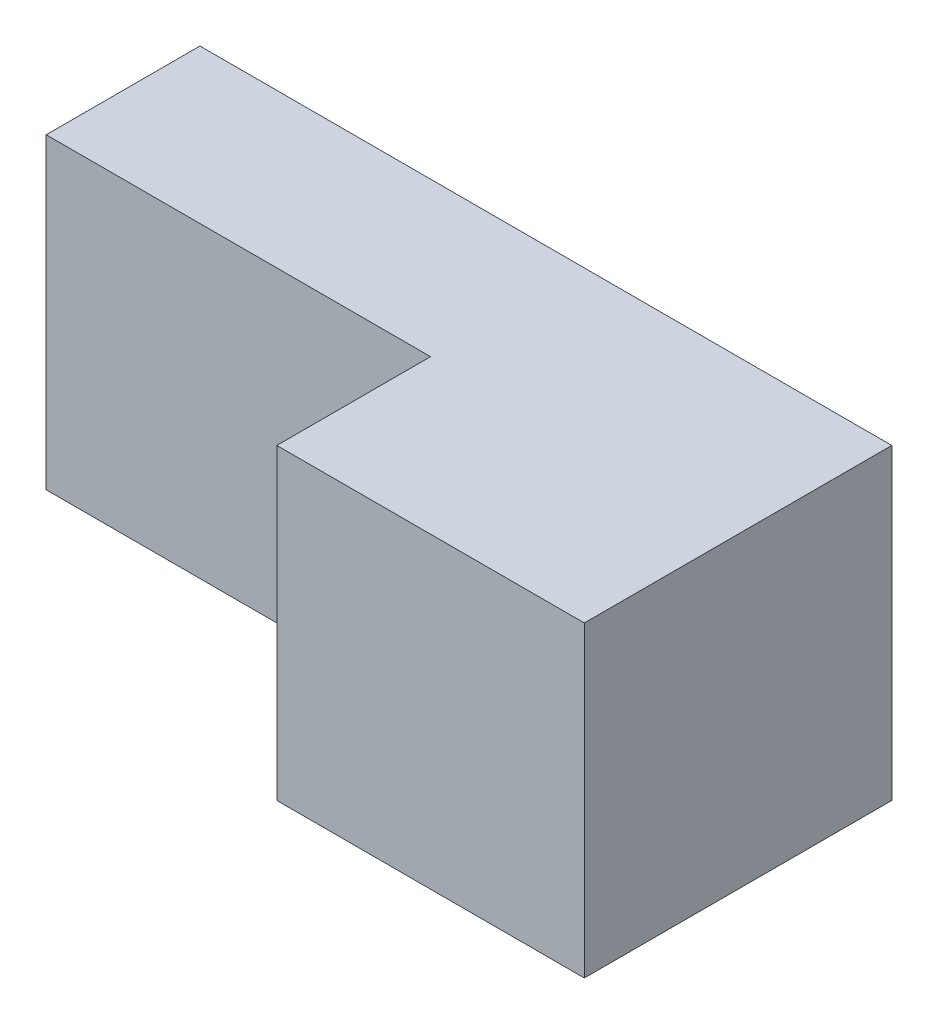
from build123d import *

# Parameters (mm, degrees)
SKETCH1_W           = 114.3
SKETCH1_H           = 50.8
BOSS_EXTRUDE1_DEPTH = 25.4
SKETCH2_W           = 50.8
SKETCH2_H           = 50.8
BOSS_EXTRUDE2_DEPTH = 25.4


with BuildPart() as part:
    # Sketch1 → Boss-Extrude1 (new body)
    with BuildSketch(Plane.XY):
        with Locations((57.15, 25.4)):
            Rectangle(SKETCH1_W, SKETCH1_H)
    extrude(amount=BOSS_EXTRUDE1_DEPTH)

    # Sketch2 → Boss-Extrude2 (add)
    with BuildSketch(Plane.XY.offset(25.4)):
        with Locations((88.9, 25.4)):
            Rectangle(SKETCH2_W, SKETCH2_H)
    extrude(amount=BOSS_EXTRUDE2_DEPTH)


solid = part.part
